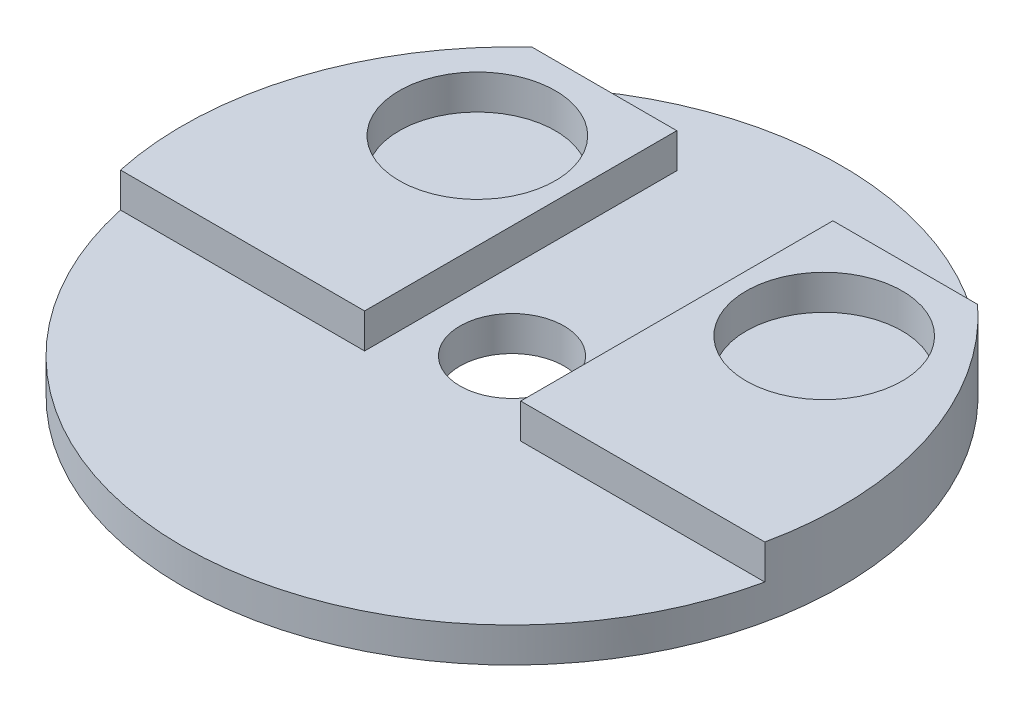
from build123d import *

# Parameters (mm, degrees)
SKETCH_1_R      = 4.75
SKETCH_1_R_2    = 0.75
EXTRUDE_1_DEPTH = 0.5
EXTRUDE_START   = 0.5
SKETCH_1_3_R    = 1.125
EXTRUDE_2_DEPTH = 0.5


with BuildPart() as part:
    # 草图1 → 凸台-拉伸1 (new body)
    with BuildSketch(Plane(origin=(0, 0, 0), x_dir=(1, 0, 0), z_dir=(0, 1, 0))):
        Circle(SKETCH_1_R)
        Circle(SKETCH_1_R_2, mode=Mode.SUBTRACT)
    extrude(amount=-EXTRUDE_1_DEPTH)

    # 草图1<3> → 凸台-拉伸2 (add)
    # profile 1 of 2: a face of its own
    with BuildSketch(Plane(origin=(0, 0, 0), x_dir=(1, 0, 0), z_dir=(0, 1, 0)).offset(EXTRUDE_START)):
        with BuildLine():
            Line((1.125, -1), (4.643543905, -1))
            ThreePointArc((4.643543905, -1), (4.526276083, 1.440598771), (3.211308145, 3.5))
            Line((3.211308145, 3.5), (1.125, 3.5))
            Line((1.125, 3.5), (1.125, -1))
        make_face()
        with Locations((2.5, 2)):
            Circle(SKETCH_1_3_R, mode=Mode.SUBTRACT)
    # profile 2 of 2: a face of its own
    with BuildSketch(Plane(origin=(0, 0, 0), x_dir=(1, 0, 0), z_dir=(0, 1, 0)).offset(EXTRUDE_START)):
        with BuildLine():
            ThreePointArc((-3.211308145, 3.5), (-4.526276083, 1.440598771), (-4.643543905, -1))
            Line((-4.643543905, -1), (-1.125, -1))
            Line((-1.125, -1), (-1.125, 3.5))
            Line((-1.125, 3.5), (-3.211308145, 3.5))
        make_face()
        with Locations((-2.5, 2)):
            Circle(SKETCH_1_3_R, mode=Mode.SUBTRACT)
    extrude(amount=-EXTRUDE_2_DEPTH)


solid = part.part
